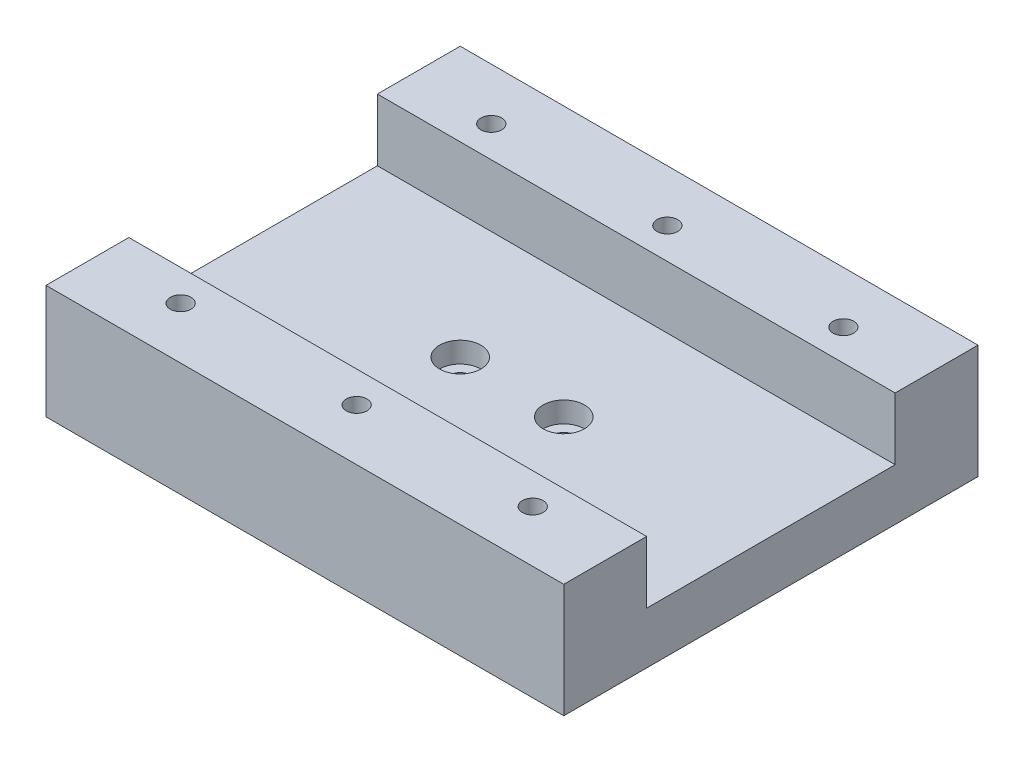
from build123d import *

# Parameters (mm, degrees)
SKETCH1_W               = 50
SKETCH1_H               = 40
BOSS_EXTRUDE1_DEPTH     = 5
SKETCH2_R               = 1
CUT_EXTRUDE1_DEPTH      = 33.403703492
SKETCH3_R               = 2
CUT_EXTRUDE2_DEPTH      = 2
SKETCH5_W               = 50
SKETCH5_H               = 8
BOSS_EXTRUDE2_DEPTH     = 6
CUT_EXTRUDE3_DEPTH      = 33.57299495
CUT_EXTRUDE3_DEPTH_BACK = 33.57299495
SKETCH4_R               = 1


with BuildPart() as part:
    # Sketch1 → Boss-Extrude1 (new body)
    with BuildSketch(Plane(origin=(0, 0, 0), x_dir=(1, 0, 0), z_dir=(0, 1, 0))):
        Rectangle(SKETCH1_W, SKETCH1_H)
    extrude(amount=BOSS_EXTRUDE1_DEPTH)

    # Sketch2 → Cut-Extrude1 (cut, through all)
    with BuildSketch(Plane(origin=(0, 5, 0), x_dir=(1, 0, 0), z_dir=(0, 1, 0))):
        with Locations(Location((-5, 0, 0), (0, 0, 270))):
            Circle(SKETCH2_R)
        with Locations(Location((5, 0, 0), (0, 0, 270))):
            Circle(SKETCH2_R)
    extrude(amount=-CUT_EXTRUDE1_DEPTH, mode=Mode.SUBTRACT)

    # Sketch3 → Cut-Extrude2 (cut)
    with BuildSketch(Plane(origin=(0, 5, 0), x_dir=(1, 0, 0), z_dir=(0, 1, 0))):
        with Locations(Location((-5, 0, 0), (0, 0, 270))):
            Circle(SKETCH3_R)
        with Locations(Location((5, 0, 0), (0, 0, 270))):
            Circle(SKETCH3_R)
    extrude(amount=-CUT_EXTRUDE2_DEPTH, mode=Mode.SUBTRACT)

    # Sketch5 → Boss-Extrude2 (add)
    with BuildSketch(Plane(origin=(0, 5, 0), x_dir=(1, 0, 0), z_dir=(0, 1, 0))):
        with Locations((0, 16)):
            Rectangle(SKETCH5_W, SKETCH5_H)
        with Locations((0, -16)):
            Rectangle(SKETCH5_W, SKETCH5_H)
    extrude(amount=BOSS_EXTRUDE2_DEPTH)

    # Sketch4 → Cut-Extrude3 (cut, two sides: drawn at the far end of the back side and taken through both)
    with BuildSketch(Plane(origin=(0, 5, 0), x_dir=(1, 0, 0), z_dir=(0, 1, 0)).offset(-CUT_EXTRUDE3_DEPTH_BACK)):
        with Locations(Location((-17, 15, 0), (0, 0, 270))):
            Circle(SKETCH4_R)
        with Locations(Location((0, 15, 0), (0, 0, 270))):
            Circle(SKETCH4_R)
        with Locations(Location((17, 15, 0), (0, 0, 270))):
            Circle(SKETCH4_R)
        with Locations(Location((-17, -15, 0), (0, 0, 270))):
            Circle(SKETCH4_R)
        with Locations(Location((0, -15, 0), (0, 0, 270))):
            Circle(SKETCH4_R)
        with Locations(Location((17, -15, 0), (0, 0, 270))):
            Circle(SKETCH4_R)
    extrude(amount=CUT_EXTRUDE3_DEPTH + CUT_EXTRUDE3_DEPTH_BACK, mode=Mode.SUBTRACT)


solid = part.part
